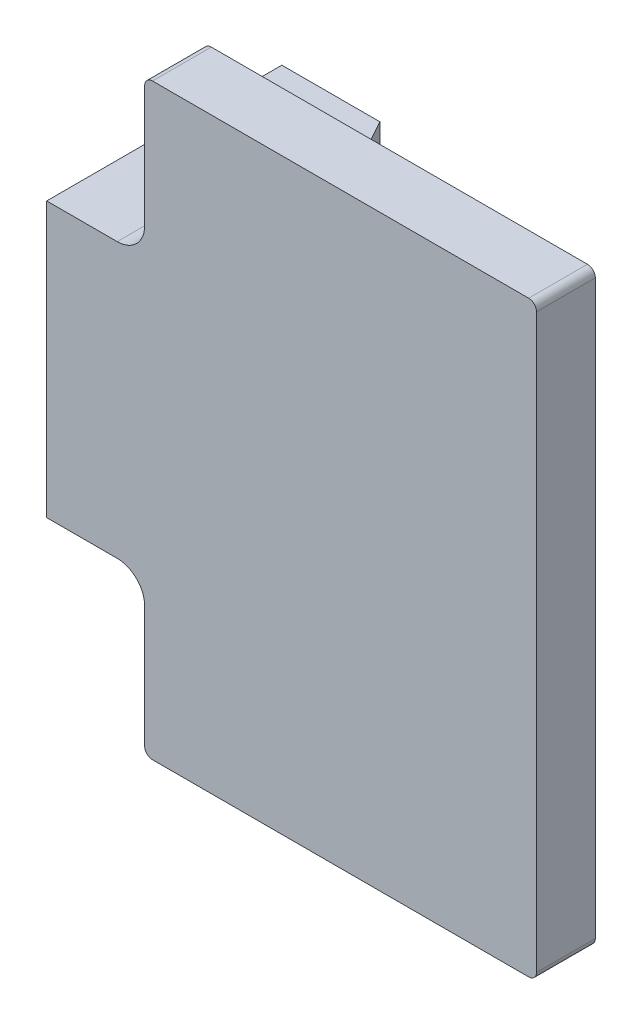
from build123d import *

# Parameters (mm, degrees)
ESQUISSE1_W                                        = 100
ESQUISSE1_H                                        = 150
BOSS_EXTRU_1_DEPTH                                 = 15
ESQUISSE2_W                                        = 25
ESQUISSE2_H                                        = 70
BOSS_EXTRU_2_DEPTH                                 = 60
ENL_V_MAT_EXTRU_1_DEPTH                            = 4.15
CHAMBRAGE_POUR_VIS_T_TE_RONDE_BOMB_E_M_D           = 3.4
CHAMBRAGE_POUR_VIS_T_TE_RONDE_BOMB_E_M_CBORE_D     = 7
CHAMBRAGE_POUR_VIS_T_TE_RONDE_BOMB_E_M_CBORE_DEPTH = 2.4
BOSS_EXTRU_3_DEPTH                                 = 10
CONG_1_R                                           = 7
CONG_2_R                                           = 2


with BuildPart() as part:
    # Esquisse1 → Boss.-Extru.1 (new body)
    with BuildSketch(Plane.XY):
        with Locations((50, 0)):
            Rectangle(ESQUISSE1_W, ESQUISSE1_H)
    extrude(amount=BOSS_EXTRU_1_DEPTH)

    # Esquisse2 → Boss.-Extru.2 (add)
    with BuildSketch(Plane.XY.offset(15)):
        with Locations((-12.5, 0)):
            Rectangle(ESQUISSE2_W, ESQUISSE2_H)
    extrude(amount=-BOSS_EXTRU_2_DEPTH)

    # Esquisse4 → Enlèv. mat.-Extru.1 (cut)
    with BuildSketch(Plane.ZY.offset(25)):
        with BuildLine():
            Line((-2.2, 0), (-2.2, 6.5))
            ThreePointArc((-2.2, 6.5), (-2.492893219, 7.207106781), (-3.2, 7.5))
            Line((-3.2, 7.5), (-9.7, 7.5))
            ThreePointArc((-9.7, 7.5), (-12.00671757, 7.13645949), (-14.089812398, 6.081081081))
            ThreePointArc((-14.089812398, 6.081081081), (-16.998209557, 4.607571798), (-20.218826659, 4.1))
            Line((-20.218826659, 4.1), (-33.7, 4.1))
            ThreePointArc((-33.7, 4.1), (-36.599137803, 2.899137803), (-37.8, 0))
            ThreePointArc((-37.8, 0), (-36.599137803, -2.899137803), (-33.7, -4.1))
            Line((-33.7, -4.1), (-20.218826659, -4.1))
            ThreePointArc((-20.218826659, -4.1), (-18.58641381, -4.22802272), (-16.993916418, -4.60896049))
            Line((-16.993916418, -4.60896049), (-16.993916418, -6.5))
            ThreePointArc((-16.993916418, -6.5), (-16.701023199, -7.207106781), (-15.993916418, -7.5))
            Line((-15.993916418, -7.5), (-9.7, -7.5))
            ThreePointArc((-9.7, -7.5), (-4.396699141, -5.303300859), (-2.2, 0))
        make_face()
    extrude(amount=-ENL_V_MAT_EXTRU_1_DEPTH, mode=Mode.SUBTRACT)

    # Chambrage pour vis à tête ronde bombée M32 (through all)
    with Locations(Plane(origin=(0, 0, -33.7), x_dir=(0, 0, 1), z_dir=(1, 0, 0))):
        with Locations((0, 0), (24, 0)):
            CounterBoreHole(CHAMBRAGE_POUR_VIS_T_TE_RONDE_BOMB_E_M_D / 2, CHAMBRAGE_POUR_VIS_T_TE_RONDE_BOMB_E_M_CBORE_D / 2, CHAMBRAGE_POUR_VIS_T_TE_RONDE_BOMB_E_M_CBORE_DEPTH)

    # Esquisse10 → Boss.-Extru.3 (add)
    with BuildSketch(Plane.XZ.offset(35)):
        Polygon((0, -45), (25, 0), (0, 0), align=None)
    boss_extru_3 = extrude(amount=-BOSS_EXTRU_3_DEPTH)

    # Symétrie1: Boss.-Extru.3 across plane
    add(boss_extru_3.mirror(Plane.ZX))

    # Congé1
    cong_1_edges = [part.edges().sort_by_distance(p)[0] for p in [
        (0, 35, 7.5),
        (0, -35, 7.5),
    ]]
    fillet(cong_1_edges, radius=CONG_1_R)

    # Congé2
    cong_2_edges = [part.edges().sort_by_distance(p)[0] for p in [
        (0, 0, 0),
        (100, -75, 7.5),
        (100, 75, 7.5),
        (0, -75, 7.5),
        (0, 75, 7.5),
    ]]
    fillet(cong_2_edges, radius=CONG_2_R)


solid = part.part
